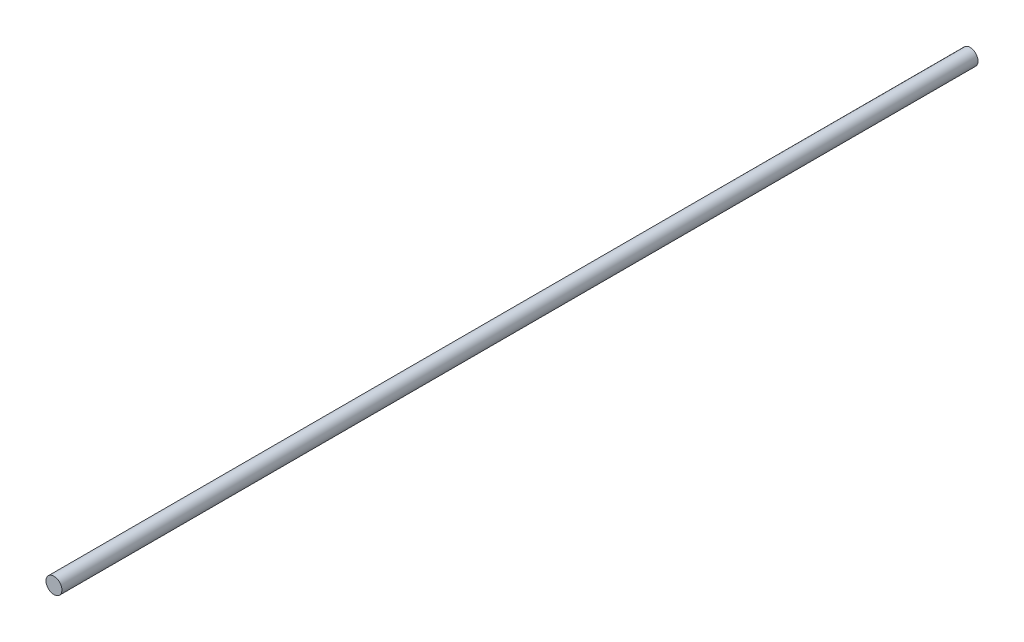
from build123d import *

# Parameters (mm, degrees)
SZKIC1_R                    = 4
DODANIE_WYCI_GNI_CIE1_DEPTH = 460


with BuildPart() as part:
    # Szkic1 → Dodanie-wyciągnięcie1 (new body)
    with BuildSketch(Plane.XY):
        Circle(SZKIC1_R)
    extrude(amount=DODANIE_WYCI_GNI_CIE1_DEPTH)


solid = part.part
